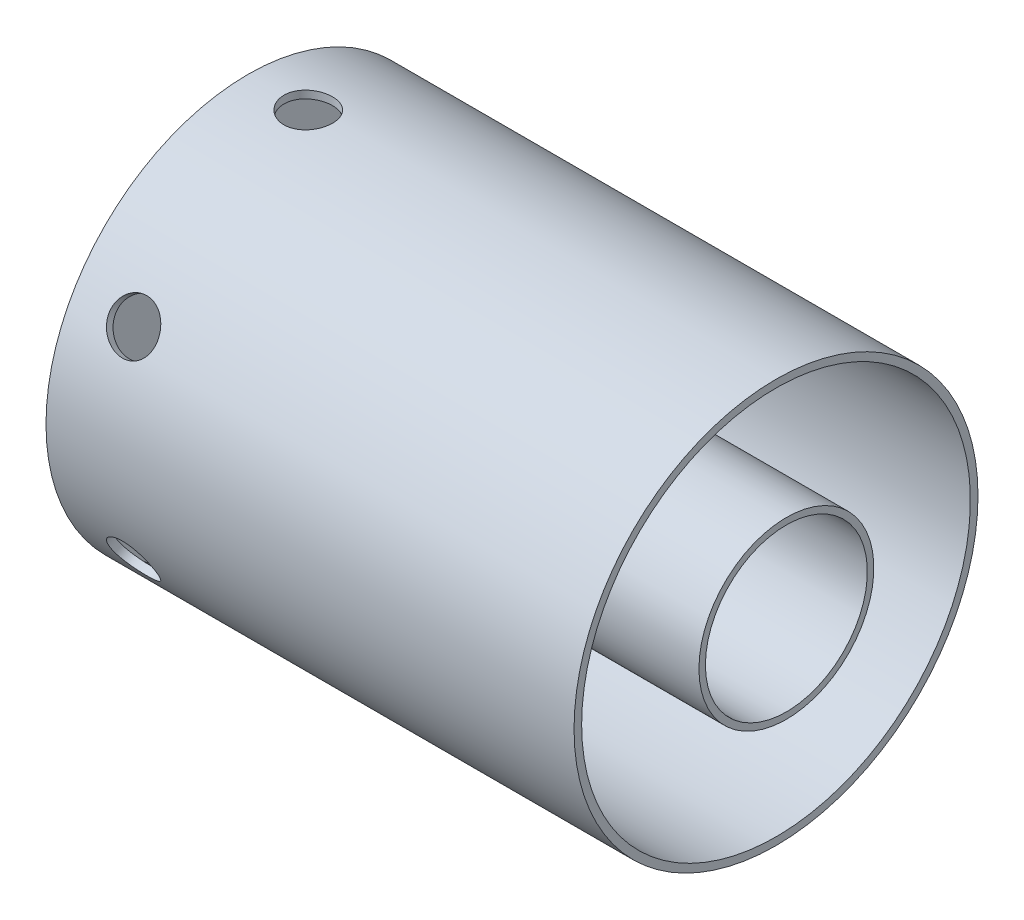
from build123d import *

# Parameters (mm, degrees)
SKETCH9_R           = 9.525
CUT_EXTRUDE9_DEPTH  = 5.842
CUT_EXTRUDE10_START = 66.04
SKETCH10_R          = 9.525
CUT_EXTRUDE10_DEPTH = 66.04
CIRPATTERN1_COUNT   = 3
CIRPATTERN2_COUNT   = 3


with BuildPart() as part:
    # Sketch2 → Revolve2 (revolve)
    with BuildSketch(Plane.XY, mode=Mode.PRIVATE) as revolve2_sk:
        Polygon((0.078657589, 79.1845), (0.078657589, 31.75), (211.152657589, 31.75), (211.152657589, 34.29), (127, 34.29), (5.162905757, 34.29), (5.162905757, 76.2), (207.088657589, 76.2), (207.088657589, 79.1845), align=None)
        Polygon((0.078657589, 79.1845), (0.078657589, 31.75), (211.152657589, 31.75), (211.152657589, 34.29), (127, 34.29), (5.162905757, 34.29), (5.162905757, 76.2), (207.088657589, 76.2), (207.088657589, 79.1845), align=None)
        Polygon((0.078657589, 79.1845), (0.078657589, 31.75), (211.152657589, 31.75), (211.152657589, 34.29), (127, 34.29), (5.162905757, 34.29), (5.162905757, 76.2), (207.088657589, 76.2), (207.088657589, 79.1845), align=None)
    revolve(revolve2_sk.sketch.rotate(Axis((0, 0, 0), (1, 0, 0)), 90), axis=Axis((0, 0, 0), (1, 0, 0)))

    # Sketch9 → Cut-Extrude9 (cut)
    with BuildSketch(Plane(origin=(0, 79.1845, 0), x_dir=(1, 0, 0), z_dir=(0, 1, 0))):
        with Locations(Location((23.718923994, 0, 0), (0, 0, 270))):
            Circle(SKETCH9_R)
    cut_extrude9 = extrude(amount=-CUT_EXTRUDE9_DEPTH, mode=Mode.SUBTRACT)

    # Sketch10 → Cut-Extrude10 (cut)
    with BuildSketch(Plane(origin=(0, -79.1845, 0), x_dir=(1, 0, 0), z_dir=(0, 1, 0)).offset(CUT_EXTRUDE10_START)):
        with Locations(Location((23.718923994, 0, 0), (0, 0, 270))):
            Circle(SKETCH10_R)
    cut_extrude10 = extrude(amount=-CUT_EXTRUDE10_DEPTH, mode=Mode.SUBTRACT)

    # CirPattern1: Cut-Extrude9 ×3 about axis
    cirpattern1_axis = Axis((0, 0, 0), (-1, 0, 0))
    for i in range(1, CIRPATTERN1_COUNT):
        add(cut_extrude9.rotate(cirpattern1_axis, i * 360 / CIRPATTERN1_COUNT), mode=Mode.SUBTRACT)

    # CirPattern2: Cut-Extrude10 ×3 about axis
    cirpattern2_axis = Axis((0, 0, 0), (-1, 0, 0))
    for i in range(1, CIRPATTERN2_COUNT):
        add(cut_extrude10.rotate(cirpattern2_axis, i * 360 / CIRPATTERN2_COUNT), mode=Mode.SUBTRACT)


solid = part.part
